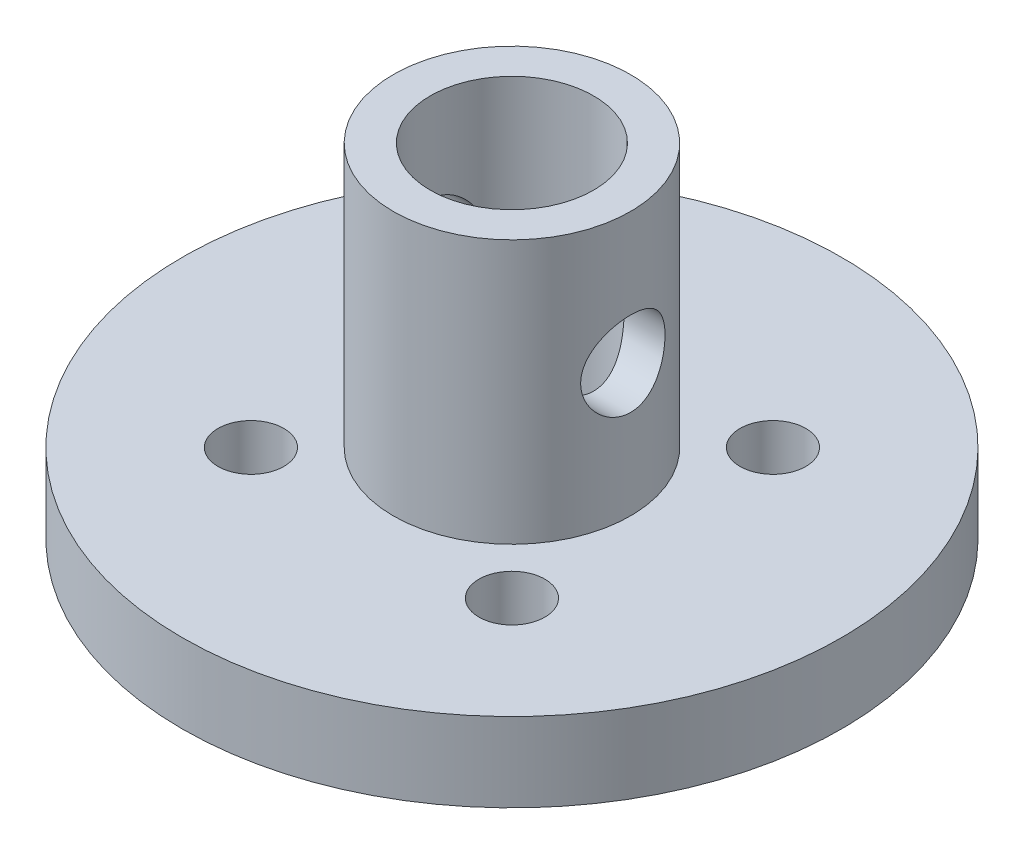
from build123d import *

# Parameters (mm, degrees)
CROQUIS1_R                 = 12.5
CROQUIS1_R_2               = 1.25
SALIENTE_EXTRUIR1_DEPTH    = 3
SALIENTE_EXTRUIR2_START    = 3
CROQUIS1_3_R               = 4.5
CROQUIS1_3_R_2             = 3.1
SALIENTE_EXTRUIR2_DEPTH    = 10
CORTAR_EXTRUIR1_DEPTH      = 22.943108257
CORTAR_EXTRUIR1_DEPTH_BACK = 22.943108257
CROQUIS2_R                 = 1.6


with BuildPart() as part:
    # Croquis1 → Saliente-Extruir1 (new body)
    with BuildSketch(Plane(origin=(0, 0, 0), x_dir=(1, 0, 0), z_dir=(0, 1, 0))):
        with Locations(Location((0, 0, 0), (0, 0, 270))):
            Circle(CROQUIS1_R)
        with Locations(Location((-4.949747468, 4.949747468, 0), (0, 0, 270))):
            Circle(CROQUIS1_R_2, mode=Mode.SUBTRACT)
        with Locations(Location((4.949747468, 4.949747468, 0), (0, 0, 270))):
            Circle(CROQUIS1_R_2, mode=Mode.SUBTRACT)
        with Locations(Location((4.949747468, -4.949747468, 0), (0, 0, 270))):
            Circle(CROQUIS1_R_2, mode=Mode.SUBTRACT)
        with Locations(Location((-4.949747468, -4.949747468, 0), (0, 0, 270))):
            Circle(CROQUIS1_R_2, mode=Mode.SUBTRACT)
    extrude(amount=SALIENTE_EXTRUIR1_DEPTH)

    # Croquis1<3> → Saliente-Extruir2 (add)
    with BuildSketch(Plane(origin=(0, 0, 0), x_dir=(1, 0, 0), z_dir=(0, 1, 0)).offset(SALIENTE_EXTRUIR2_START)):
        with Locations(Location((0, 0, 0), (0, 0, 270))):
            Circle(CROQUIS1_3_R)
        with Locations(Location((0, 0, 0), (0, 0, 270))):
            Circle(CROQUIS1_3_R_2, mode=Mode.SUBTRACT)
    extrude(amount=SALIENTE_EXTRUIR2_DEPTH)

    # Croquis2 → Cortar-Extruir1 (cut, two sides: drawn at the far end of the back side and taken through both)
    with BuildSketch(Plane(origin=(0, 0, 0), x_dir=(0, 0, -1), z_dir=(1, 0, 0)).offset(-CORTAR_EXTRUIR1_DEPTH_BACK)):
        with Locations((0, 8)):
            Circle(CROQUIS2_R)
    extrude(amount=CORTAR_EXTRUIR1_DEPTH + CORTAR_EXTRUIR1_DEPTH_BACK, mode=Mode.SUBTRACT)


solid = part.part
